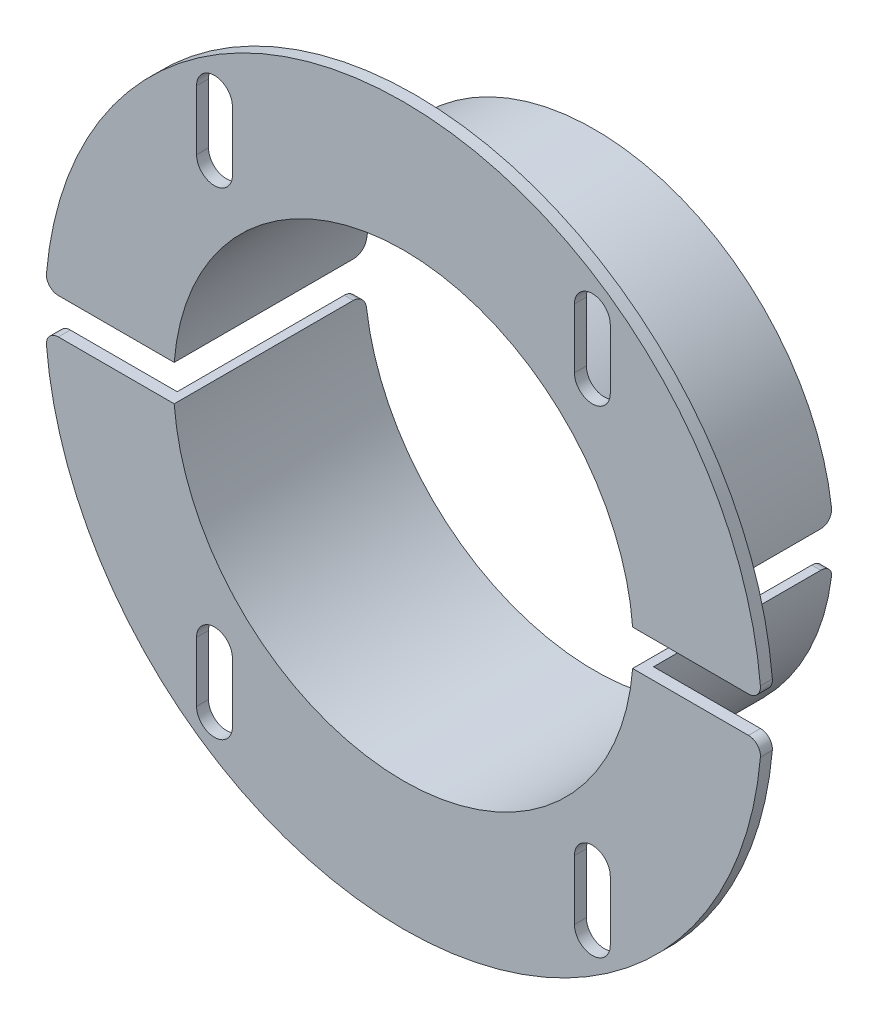
from build123d import *

# Parameters (mm, degrees)
SKETCH_1_R          = 40
SKETCH_1_R_2        = 38.5
EXTRUDE_1_DEPTH     = 30
SKETCH_3_R          = 60
SKETCH_3_R_2        = 38.5
EXTRUDE_2_DEPTH     = 2
CUT_EXTRUDE_3_DEPTH = 91
SKETCH_2_W          = 200
SKETCH_2_H          = 6
CUT_EXTRUDE_2_DEPTH = 2000
FILLET_1_R          = 2
FILLET_2_R          = 2


with BuildPart() as part:
    # 草图1 → 凸台-拉伸1 (new body)
    with BuildSketch(Plane.XY):
        Circle(SKETCH_1_R)
        Circle(SKETCH_1_R_2, mode=Mode.SUBTRACT)
    extrude(amount=EXTRUDE_1_DEPTH)

    # 草图3 → 凸台-拉伸2 (add)
    with BuildSketch(Plane.XY.offset(30)):
        Circle(SKETCH_3_R)
        Circle(SKETCH_3_R_2, mode=Mode.SUBTRACT)
    extrude(amount=EXTRUDE_2_DEPTH)

    # 草图4 → 切除-拉伸3 (cut, through all)
    with BuildSketch(Plane(origin=(0, 0, 30), x_dir=(-1, 0, 0), z_dir=(0, 0, -1))):
        with BuildLine():
            Line((-34.638584039, -45), (-34.638584039, -35))
            ThreePointArc((-34.638584039, -35), (-31.638584039, -32), (-28.638584039, -35))
            Line((-28.638584039, -35), (-28.638584039, -45))
            ThreePointArc((-28.638584039, -45), (-31.638584039, -48), (-34.638584039, -45))
        make_face()
        with BuildLine():
            Line((28.638584039, -45), (28.638584039, -35))
            ThreePointArc((28.638584039, -35), (31.638584039, -32), (34.638584039, -35))
            Line((34.638584039, -35), (34.638584039, -45))
            ThreePointArc((34.638584039, -45), (31.638584039, -48), (28.638584039, -45))
        make_face()
        with BuildLine():
            Line((28.638584039, 35), (28.638584039, 45))
            ThreePointArc((28.638584039, 45), (31.638584039, 48), (34.638584039, 45))
            Line((34.638584039, 45), (34.638584039, 35))
            ThreePointArc((34.638584039, 35), (31.638584039, 32), (28.638584039, 35))
        make_face()
        with BuildLine():
            Line((-34.638584039, 35), (-34.638584039, 45))
            ThreePointArc((-34.638584039, 45), (-31.638584039, 48), (-28.638584039, 45))
            Line((-28.638584039, 45), (-28.638584039, 35))
            ThreePointArc((-28.638584039, 35), (-31.638584039, 32), (-34.638584039, 35))
        make_face()
    extrude(amount=-CUT_EXTRUDE_3_DEPTH, mode=Mode.SUBTRACT)

    # 草图2 → 切除-拉伸2 (cut)
    with BuildSketch(Plane(origin=(0, 0, 0), x_dir=(-1, 0, 0), z_dir=(0, 0, -1))):
        Rectangle(SKETCH_2_W, SKETCH_2_H)
    extrude(amount=-CUT_EXTRUDE_2_DEPTH, mode=Mode.SUBTRACT)


with BuildPart() as cut_extrude_2_piece_1:
    # of the separate pieces the step leaves, piece 1, a body of its own (cut_extrude_2_pieces)
    add(part.part.solids().sort_by_distance((-39.88734135, -3, 0))[0])

    # 圆角1
    fillet_1_edges = [cut_extrude_2_piece_1.edges().sort_by_distance(p)[0] for p in [
        (59.924953066, -3, 31),
        (-59.924953066, -3, 31),
        (-39.135140134, -3, 0),
        (39.135140134, -3, 0),
    ]]
    fillet(fillet_1_edges, radius=FILLET_1_R)


with BuildPart() as cut_extrude_2_piece_2:
    # of the separate pieces the step leaves, piece 2, a body of its own (cut_extrude_2_pieces)
    add(part.part.solids().sort_by_distance((39.88734135, 3, 0))[0])

    # 圆角2
    fillet_2_edges = [cut_extrude_2_piece_2.edges().sort_by_distance(p)[0] for p in [
        (59.924953066, 3, 31),
        (-59.924953066, 3, 31),
        (-39.135140134, 3, 0),
        (39.135140134, 3, 0),
    ]]
    fillet(fillet_2_edges, radius=FILLET_2_R)


solid = Compound([cut_extrude_2_piece_1.part, cut_extrude_2_piece_2.part])
